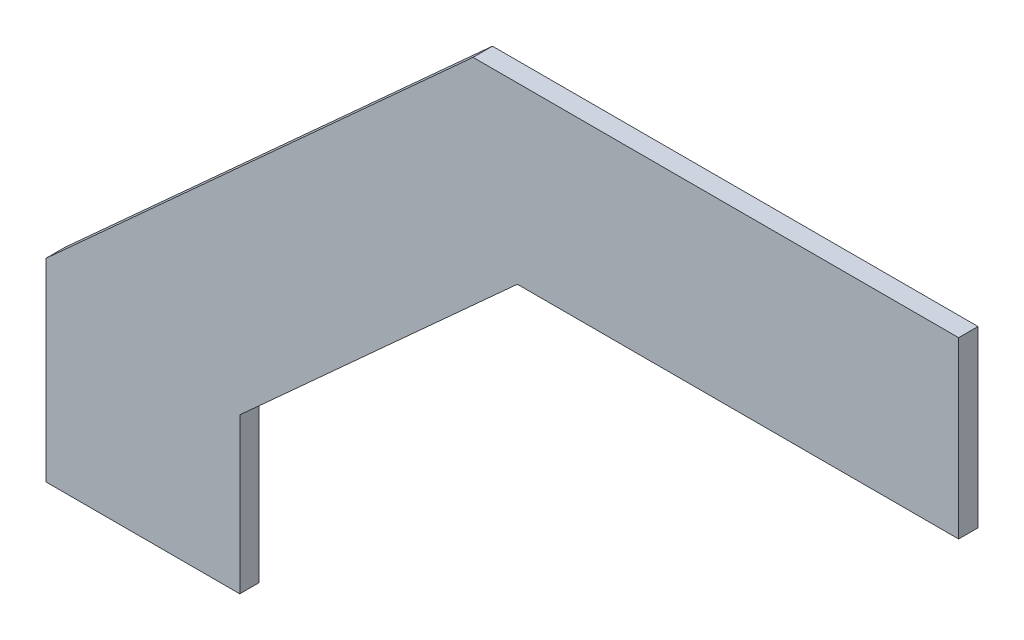
from build123d import *

# Parameters (mm, degrees)
BOSS_EXTRUDE1_DEPTH = 0.05


with BuildPart() as part:
    # Sketch1 → Boss-Extrude1 (new, symmetric)
    with BuildSketch(Plane.XY):
        Polygon((0, 0), (1, 0), (1, 0.8), (2.432697838, 2.1), (4.71, 2.1), (4.71, 3), (2.204150519, 3), (0, 1), align=None)
    extrude(amount=BOSS_EXTRUDE1_DEPTH, both=True)


solid = part.part
